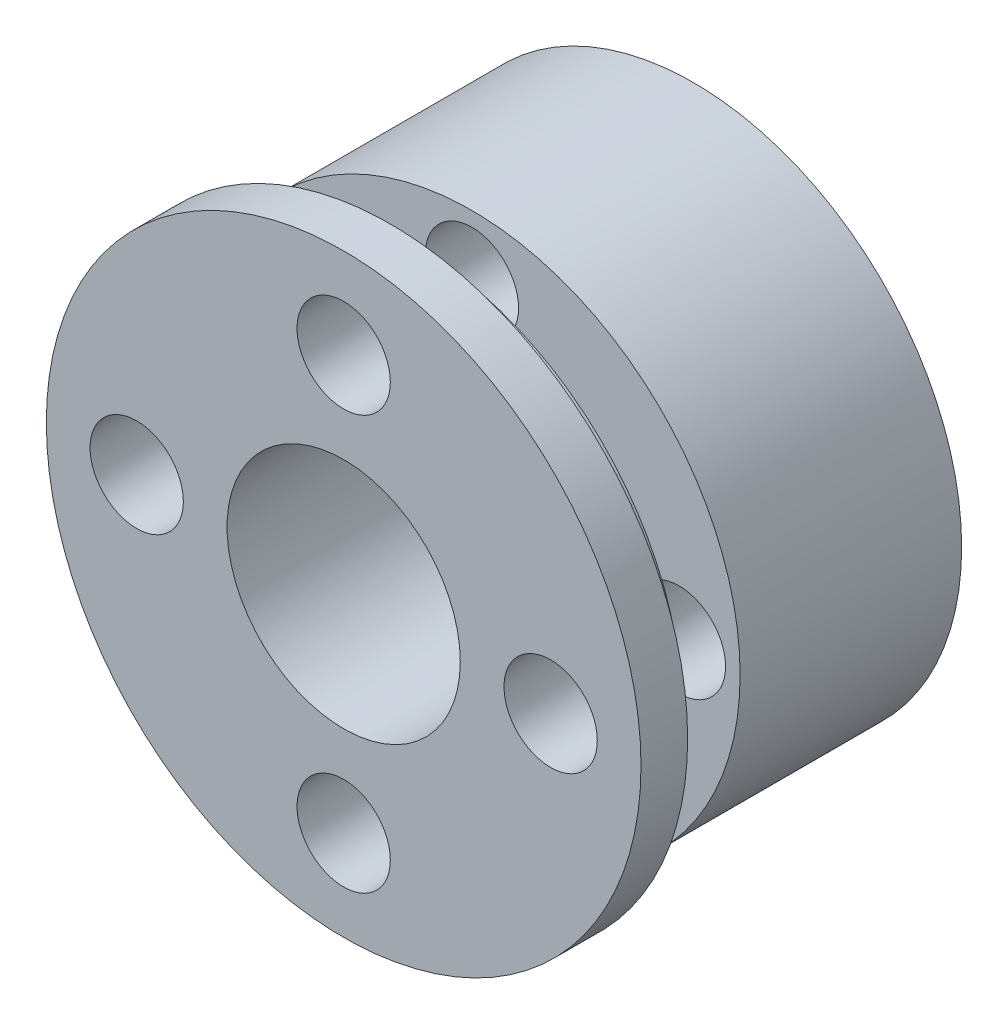
from build123d import *

# Parameters (mm, degrees)
SKETCH2_R          = 5
CUT_EXTRUDE1_DEPTH = 24.454743657
SKETCH3_R          = 2
CUT_EXTRUDE2_DEPTH = 24.454743657


with BuildPart() as part:
    # Sketch1 → Revolve1 (revolve)
    with BuildSketch(Plane(origin=(0, 0, 0), x_dir=(0, 0, -1), z_dir=(1, 0, 0)), mode=Mode.PRIVATE) as revolve1_sk:
        Polygon((0, 0), (0, 11.5), (-9.5, 11.5), (-9.5, 6), (-12, 6), (-12, 11.5), (-13, 11.5), (-13, 12.75), (-15, 12.75), (-15, 0), align=None)
    revolve(revolve1_sk.sketch.rotate(Axis((0, 0, 15), (0, 0, -1)), 90), axis=Axis((0, 0, 15), (0, 0, -1)))

    # Sketch2 → Cut-Extrude1 (cut, through all)
    with BuildSketch(Plane.XY.offset(15)):
        Circle(SKETCH2_R)
    extrude(amount=-CUT_EXTRUDE1_DEPTH, mode=Mode.SUBTRACT)

    # Sketch3 → Cut-Extrude2 (cut, through all)
    with BuildSketch(Plane.XY.offset(15)):
        with Locations((0, 8.875)):
            Circle(SKETCH3_R)
        with Locations((8.875, 0)):
            Circle(SKETCH3_R)
        with Locations((0, -8.875)):
            Circle(SKETCH3_R)
        with Locations((-8.875, 0)):
            Circle(SKETCH3_R)
    extrude(amount=-CUT_EXTRUDE2_DEPTH, mode=Mode.SUBTRACT)


solid = part.part
